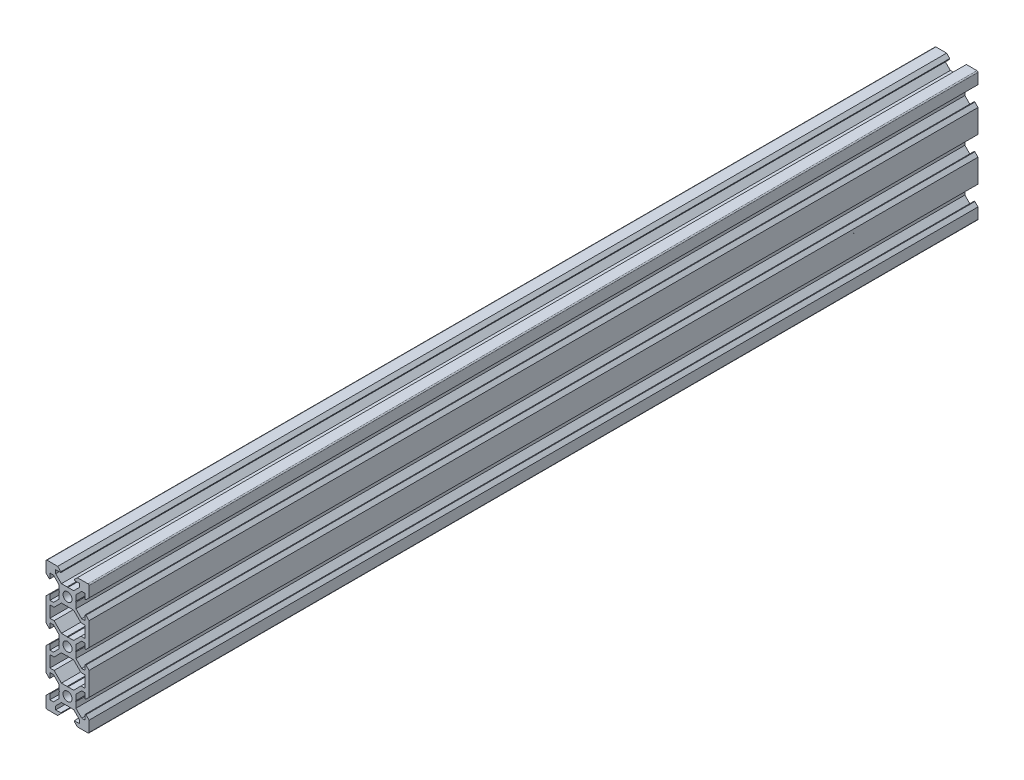
from build123d import *

# Parameters (mm, degrees)
BOSS_EXTRU_1_DEPTH = 412.76


with BuildPart() as part:
    # Esquisse1 → Boss.-Extru.1 (new body)
    with BuildSketch(Plane.XY):
        with BuildLine():
            Line((-9.5, 10), (-4.58, 10))
            Line((-4.58, 10), (-3.125, 8.545))
            Line((-3.125, 8.545), (-3.125, 8.2))
            Line((-3.125, 8.2), (-5.5, 8.2))
            Line((-5.5, 8.2), (-5.5, 6.560660172))
            Line((-5.5, 6.560660172), (-2.839339828, 3.9))
            Line((-2.839339828, 3.9), (-0.21, 3.9))
            Line((-0.21, 3.9), (0, 3.69))
            Line((0, 3.69), (0, 2.1))
            ThreePointArc((0, 2.1), (-2.1, 0), (0, -2.1))
            Line((0, -2.1), (0, -3.69))
            Line((0, -3.69), (-0.21, -3.9))
            Line((-0.21, -3.9), (-2.839339828, -3.9))
            Line((-2.839339828, -3.9), (-6.239339828, -7.3))
            Line((-6.239339828, -7.3), (-8.2, -7.3))
            Line((-8.2, -7.3), (-8.2, -12.7))
            Line((-8.2, -12.7), (-6.239339828, -12.7))
            Line((-6.239339828, -12.7), (-2.839339828, -16.1))
            Line((-2.839339828, -16.1), (-0.21, -16.1))
            Line((-0.21, -16.1), (0, -16.31))
            Line((0, -16.31), (0, -17.9))
            ThreePointArc((0, -17.9), (-2.1, -20), (0, -22.1))
            Line((0, -22.1), (0, -23.69))
            Line((0, -23.69), (-0.21, -23.9))
            Line((-0.21, -23.9), (-2.839339828, -23.9))
            Line((-2.839339828, -23.9), (-6.239339828, -27.3))
            Line((-6.239339828, -27.3), (-8.2, -27.3))
            Line((-8.2, -27.3), (-8.2, -32.7))
            Line((-8.2, -32.7), (-6.239339828, -32.7))
            Line((-6.239339828, -32.7), (-2.839339828, -36.1))
            Line((-2.839339828, -36.1), (-0.21, -36.1))
            Line((-0.21, -36.1), (0, -36.31))
            Line((0, -36.31), (0, -37.9))
            ThreePointArc((0, -37.9), (-2.1, -40), (0, -42.1))
            Line((0, -42.1), (0, -43.69))
            Line((0, -43.69), (-0.21, -43.9))
            Line((-0.21, -43.9), (-2.839339828, -43.9))
            Line((-2.839339828, -43.9), (-5.5, -46.560660172))
            Line((-5.5, -46.560660172), (-5.5, -48.2))
            Line((-5.5, -48.2), (-3.125, -48.2))
            Line((-3.125, -48.2), (-3.125, -48.545))
            Line((-3.125, -48.545), (-4.58, -50))
            Line((-4.58, -50), (-9.5, -50))
            ThreePointArc((-9.5, -50), (-9.853553391, -49.853553391), (-10, -49.5))
            Line((-10, -49.5), (-10, -44.58))
            Line((-10, -44.58), (-8.545, -43.125))
            Line((-8.545, -43.125), (-8.2, -43.125))
            Line((-8.2, -43.125), (-8.2, -45.5))
            Line((-8.2, -45.5), (-6.560660172, -45.5))
            Line((-6.560660172, -45.5), (-3.9, -42.839339828))
            Line((-3.9, -42.839339828), (-3.9, -40.21))
            Line((-3.9, -40.21), (-3.69, -40))
            Line((-3.69, -40), (-3.9, -39.79))
            Line((-3.9, -39.79), (-3.9, -37.160660172))
            Line((-3.9, -37.160660172), (-6.560660172, -34.5))
            Line((-6.560660172, -34.5), (-8.2, -34.5))
            Line((-8.2, -34.5), (-8.2, -36.875))
            Line((-8.2, -36.875), (-8.545, -36.875))
            Line((-8.545, -36.875), (-10, -35.42))
            Line((-10, -35.42), (-10, -24.58))
            Line((-10, -24.58), (-8.545, -23.125))
            Line((-8.545, -23.125), (-8.2, -23.125))
            Line((-8.2, -23.125), (-8.2, -25.5))
            Line((-8.2, -25.5), (-6.560660172, -25.5))
            Line((-6.560660172, -25.5), (-3.9, -22.839339828))
            Line((-3.9, -22.839339828), (-3.9, -20.21))
            Line((-3.9, -20.21), (-3.69, -20))
            Line((-3.69, -20), (-3.9, -19.79))
            Line((-3.9, -19.79), (-3.9, -17.160660172))
            Line((-3.9, -17.160660172), (-6.560660172, -14.5))
            Line((-6.560660172, -14.5), (-8.2, -14.5))
            Line((-8.2, -14.5), (-8.2, -16.875))
            Line((-8.2, -16.875), (-8.545, -16.875))
            Line((-8.545, -16.875), (-10, -15.42))
            Line((-10, -15.42), (-10, -4.58))
            Line((-10, -4.58), (-8.545, -3.125))
            Line((-8.545, -3.125), (-8.2, -3.125))
            Line((-8.2, -3.125), (-8.2, -5.5))
            Line((-8.2, -5.5), (-6.560660172, -5.5))
            Line((-6.560660172, -5.5), (-3.9, -2.839339828))
            Line((-3.9, -2.839339828), (-3.9, -0.21))
            Line((-3.9, -0.21), (-3.69, 0))
            Line((-3.69, 0), (-3.9, 0.21))
            Line((-3.9, 0.21), (-3.9, 2.839339828))
            Line((-3.9, 2.839339828), (-6.560660172, 5.5))
            Line((-6.560660172, 5.5), (-8.2, 5.5))
            Line((-8.2, 5.5), (-8.2, 3.125))
            Line((-8.2, 3.125), (-8.545, 3.125))
            Line((-8.545, 3.125), (-10, 4.58))
            Line((-10, 4.58), (-10, 9.5))
            ThreePointArc((-10, 9.5), (-9.853553391, 9.853553391), (-9.5, 10))
        make_face()
    boss_extru_1 = extrude(amount=BOSS_EXTRU_1_DEPTH)

    # Symétrie1: Boss.-Extru.1 across plane
    add(boss_extru_1.mirror(Plane(origin=(0, 3.69, 412.76), x_dir=(0, 0, 1), z_dir=(-1, 0, 0))))


solid = part.part
